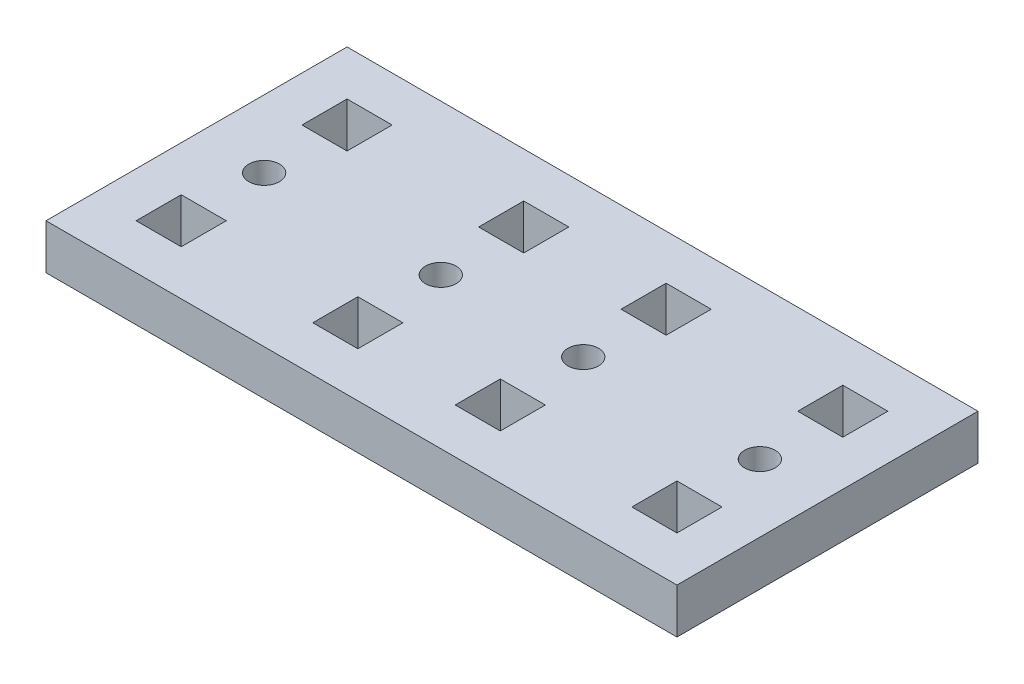
from build123d import *

# Parameters (mm, degrees)
ELEVATOR_SPACER_W   = 88.9
ELEVATOR_SPACER_H   = 42.418
ELEVATOR_SPACER_R   = 2.159
ELEVATOR_SPACER_W_2 = 6.35
ELEVATOR_SPACER_H_2 = 6.35
BOSS_EXTRUDE1_DEPTH = 6.35


with BuildPart() as part:
    # Elevator Spacer → Boss-Extrude1 (new body)
    with BuildSketch(Plane(origin=(0, 0, 0), x_dir=(1, 0, 0), z_dir=(0, 1, 0))):
        Rectangle(ELEVATOR_SPACER_W, ELEVATOR_SPACER_H)
        with Locations(Location((34.925, 0, 0), (0, 0, 270))):
            Circle(ELEVATOR_SPACER_R, mode=Mode.SUBTRACT)
        with Locations(Location((10.033, 0, 0), (0, 0, 270))):
            Circle(ELEVATOR_SPACER_R, mode=Mode.SUBTRACT)
        with Locations(Location((-10.033, 0, 0), (0, 0, 90))):
            Circle(ELEVATOR_SPACER_R, mode=Mode.SUBTRACT)
        with Locations(Location((-34.925, 0, 0), (0, 0, 90))):
            Circle(ELEVATOR_SPACER_R, mode=Mode.SUBTRACT)
        with Locations((34.925, 11.684)):
            Rectangle(ELEVATOR_SPACER_W_2, ELEVATOR_SPACER_H_2, mode=Mode.SUBTRACT)
        with Locations((34.925, -11.684)):
            Rectangle(ELEVATOR_SPACER_W_2, ELEVATOR_SPACER_H_2, mode=Mode.SUBTRACT)
        with Locations((10.033, 11.684)):
            Rectangle(ELEVATOR_SPACER_W_2, ELEVATOR_SPACER_H_2, mode=Mode.SUBTRACT)
        with Locations((10.033, -11.684)):
            Rectangle(ELEVATOR_SPACER_W_2, ELEVATOR_SPACER_H_2, mode=Mode.SUBTRACT)
        with Locations((-10.033, -11.684)):
            Rectangle(ELEVATOR_SPACER_W_2, ELEVATOR_SPACER_H_2, mode=Mode.SUBTRACT)
        with Locations((-10.033, 11.684)):
            Rectangle(ELEVATOR_SPACER_W_2, ELEVATOR_SPACER_H_2, mode=Mode.SUBTRACT)
        with Locations((-34.925, -11.684)):
            Rectangle(ELEVATOR_SPACER_W_2, ELEVATOR_SPACER_H_2, mode=Mode.SUBTRACT)
        with Locations((-34.925, 11.684)):
            Rectangle(ELEVATOR_SPACER_W_2, ELEVATOR_SPACER_H_2, mode=Mode.SUBTRACT)
    extrude(amount=BOSS_EXTRUDE1_DEPTH)


solid = part.part
